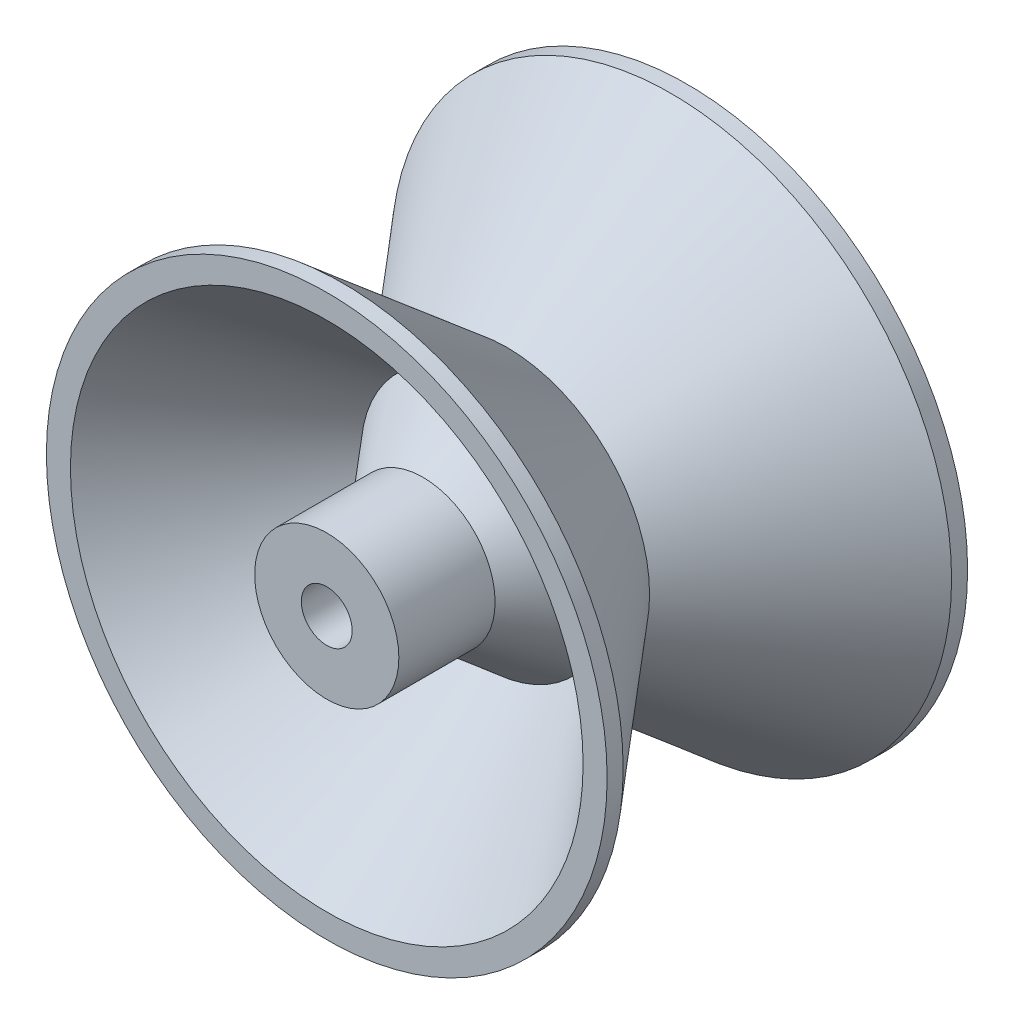
from build123d import *


with BuildPart() as part:
    # Sketch1 → Revolve1 (revolve)
    with BuildSketch(Plane(origin=(0, 0, 0), x_dir=(1, 0, 0), z_dir=(0, 1, 0))):
        with BuildLine():
            Line((3.175, 0), (3.175, 5))
            ThreePointArc((3.175, 5), (4.529564638, 7.346174775), (5, 10.014146291))
            Line((5, 10.014146291), (5, 34.985853709))
            ThreePointArc((5, 34.985853709), (4.529564638, 37.653825225), (3.175, 40))
            Line((3.175, 40), (3.175, 45))
            Line((3.175, 45), (9, 45))
            Line((9, 45), (9, 32.985593407))
            Line((9, 32.985593407), (15.45935793, 25.287630389))
            Line((15.45935793, 25.287630389), (32, 45))
            Line((32, 45), (35, 45))
            Line((35, 45), (35, 43))
            Line((35, 43), (17.798457561, 22.5))
            Line((17.798457561, 22.5), (35, 2))
            Line((35, 2), (35, 0))
            Line((35, 0), (32, 0))
            Line((32, 0), (15.45935793, 19.712369611))
            Line((15.45935793, 19.712369611), (9, 12.014406593))
            Line((9, 12.014406593), (9, 0))
            Line((9, 0), (3.175, 0))
        make_face()
    revolve(axis=Axis((0, 0, 0), (0, 0, -1)))


solid = part.part
